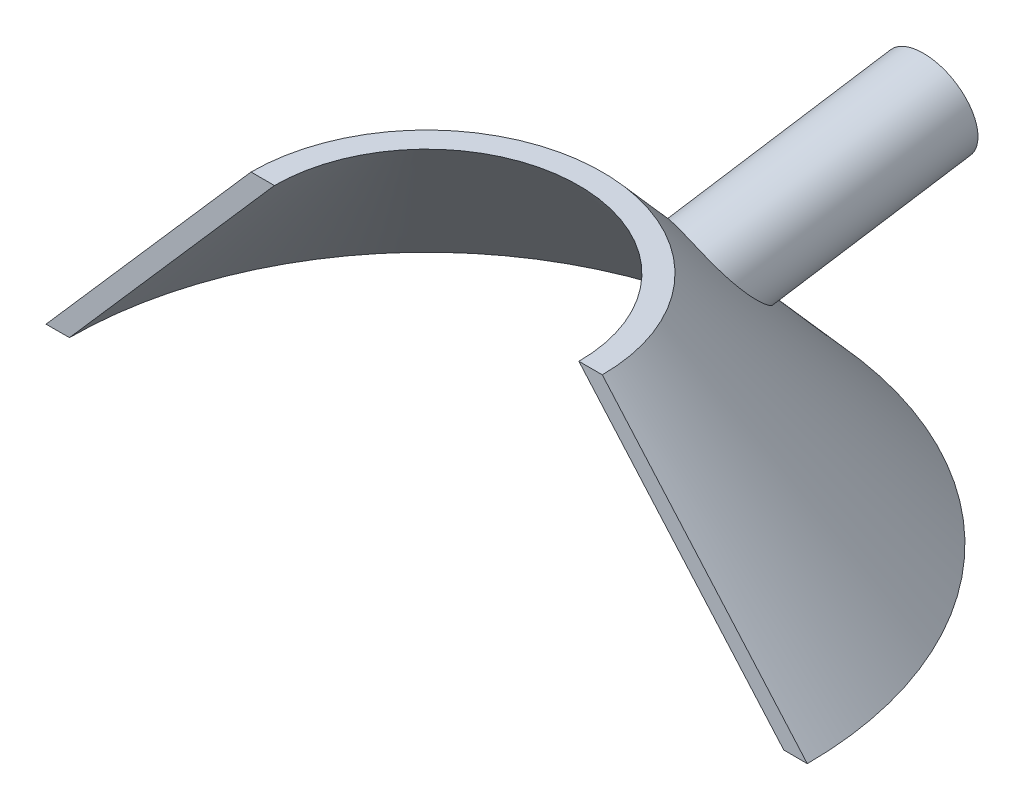
from build123d import *

# Parameters (mm, degrees)
REVOLVE1_ANGLE                  = 180
SKETCH3_R                       = 26
CUT_EXTRUDE1_DEPTH              = 10
SKETCH6_R                       = 8
BOSS_EXTRUDE2_DEPTH             = 35
BOSS_EXTRUDE2_DIRECTION_2_REACH = 133.642
CUT_EXTRUDE8_DEPTH              = 35
CUT_EXTRUDE8_DEPTH_BACK         = 10
SKETCH6_6_R                     = 6.5
SKETCH7_W                       = 164.845441074
SKETCH7_H                       = 52.750628287
CUT_EXTRUDE9_DEPTH              = 109.712015004


with BuildPart() as part:
    # Sketch1 → Revolve1 (revolve)
    with BuildSketch(Plane.XY):
        Polygon((26, 40), (61, 0), (65.013813376, -0.015786716), (30, 40), align=None)
    revolve1 = revolve(axis=Axis((0, 40, 0), (0, -1, 0)), revolution_arc=REVOLVE1_ANGLE)

    # Sketch3 → Cut-Extrude1 (cut)
    with BuildSketch(Plane(origin=(0, 32.212389381, 36.814159292), x_dir=(1, 0, 0), z_dir=(0, 0.6585046078685183, 0.7525766947068778))):
        with Locations((0, -20.352106134)):
            Circle(SKETCH3_R)
    extrude(amount=-CUT_EXTRUDE1_DEPTH, mode=Mode.SUBTRACT)

    # Mirror1: Revolve1 across plane
    add(revolve1.mirror(Plane.XY))

    # Sketch6 → Boss-Extrude2 (add)
    with BuildSketch(Plane(origin=(9.948450871, 26.808829171, -41.542274476), x_dir=(-1, 0, 0), z_dir=(0, 0.15372802298718932, -0.9881131994606945))):
        Circle(SKETCH6_R)
    extrude(amount=BOSS_EXTRUDE2_DEPTH)

    # Sketch6 → Boss-Extrude2 direction 2 (add, up to next)
    with BuildSketch(Plane(origin=(9.948450871, 26.808829171, -41.542274476), x_dir=(-1, 0, 0), z_dir=(0, 0.15372802298718932, -0.9881131994606945)), mode=Mode.PRIVATE) as boss_extrude2_direction_2_sk1:
        Circle(SKETCH6_R)
    boss_extrude2_direction_2_tool1 = extrude(boss_extrude2_direction_2_sk1.sketch, amount=-BOSS_EXTRUDE2_DIRECTION_2_REACH, mode=Mode.PRIVATE) - part.part
    add(boss_extrude2_direction_2_tool1.solids().sort_by_distance((9.948451, 26.808829, -41.542274))[0])

    # Sketch6<6> → Cut-Extrude8 (cut, two sides: drawn at the far end of the back side and taken through both)
    with BuildSketch(Plane(origin=(9.948450871, 26.808829171, -41.542274476), x_dir=(-1, 0, 0), z_dir=(0, 0.15372802298718932, -0.9881131994606945)).offset(-CUT_EXTRUDE8_DEPTH_BACK)):
        Circle(SKETCH6_6_R)
    extrude(amount=CUT_EXTRUDE8_DEPTH + CUT_EXTRUDE8_DEPTH_BACK, mode=Mode.SUBTRACT)

    # Sketch7 → Cut-Extrude9 (cut, through all)
    with BuildSketch(Plane.XY):
        with Locations((11.116613387, 15.529637373)):
            Rectangle(SKETCH7_W, SKETCH7_H)
    extrude(amount=CUT_EXTRUDE9_DEPTH, mode=Mode.SUBTRACT)


solid = part.part
